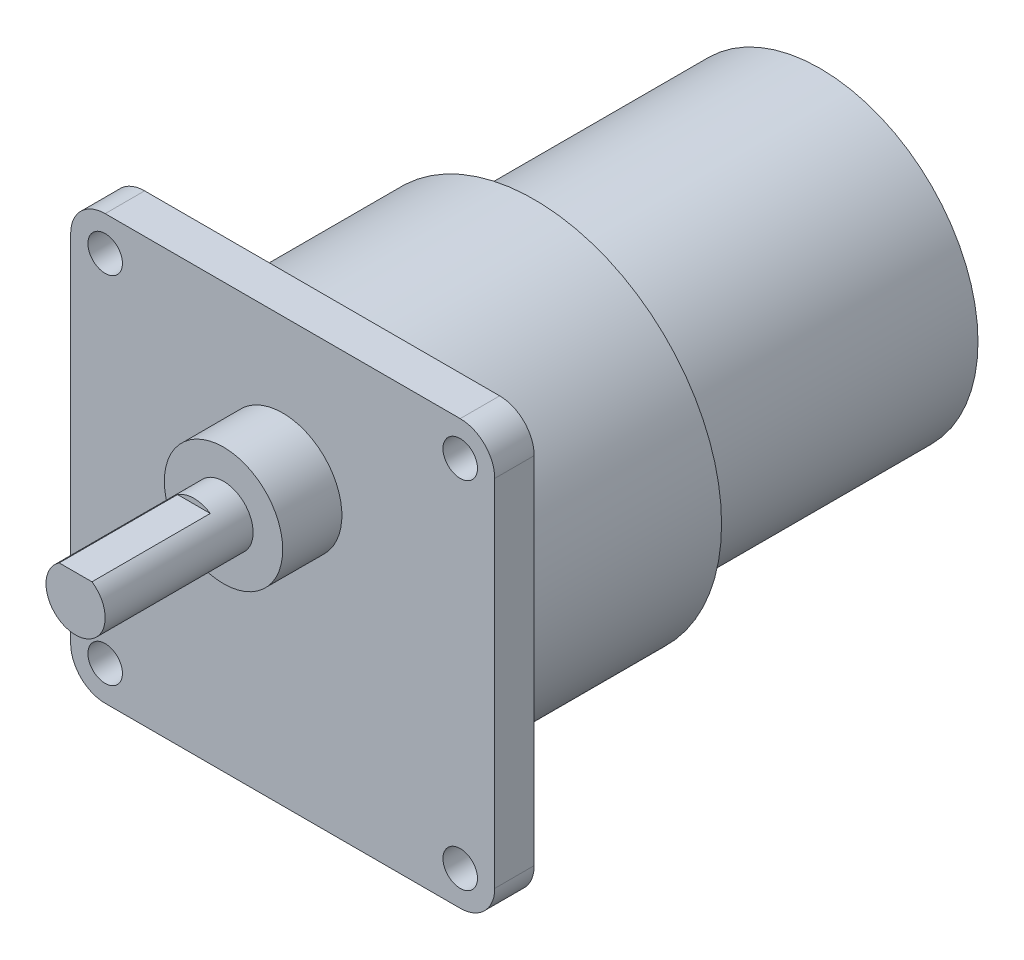
from build123d import *

# Parameters (mm, degrees)
SKETCH_1_W          = 43
SKETCH_1_H          = 43
EXTRUDE_1_DEPTH     = 4
FILLET_1_R          = 3.5
SKETCH_2_R          = 1.75
CUT_EXTRUDE_1_DEPTH = 31.66757245
SKETCH_3_R          = 6
EXTRUDE_2_DEPTH     = 6
SKETCH_4_R          = 3
EXTRUDE_3_DEPTH     = 15
CUT_EXTRUDE_START   = -12
CUT_EXTRUDE_2_DEPTH = 12
SKETCH_6_R          = 19
EXTRUDE_4_DEPTH     = 21.5
SKETCH_7_R          = 16
EXTRUDE_5_DEPTH     = 29


with BuildPart() as part:
    # 스케치1 → 보스-돌출1 (new body)
    with BuildSketch(Plane.XY):
        Rectangle(SKETCH_1_W, SKETCH_1_H)
    extrude(amount=EXTRUDE_1_DEPTH)

    # 필렛1
    fillet_1_edges = [part.edges().sort_by_distance(p)[0] for p in [
        (21.5, -21.5, 2),
        (-21.5, -21.5, 2),
        (-21.5, 21.5, 2),
        (21.5, 21.5, 2),
    ]]
    fillet(fillet_1_edges, radius=FILLET_1_R)

    # 스케치2 → 컷-돌출1 (cut, through all)
    with BuildSketch(Plane.XY.offset(4)):
        with Locations((18, 18)):
            Circle(SKETCH_2_R)
        with Locations(Location((-18, 18, 0), (0, 0, 180))):
            Circle(SKETCH_2_R)
        with Locations(Location((18, -18, 0), (0, 0, 180))):
            Circle(SKETCH_2_R)
        with Locations((-18, -18)):
            Circle(SKETCH_2_R)
    extrude(amount=-CUT_EXTRUDE_1_DEPTH, mode=Mode.SUBTRACT)

    # 스케치3 → 보스-돌출2 (add)
    with BuildSketch(Plane.XY.offset(4)):
        with Locations(Location((0, 7, 0), (0, 0, 180))):
            Circle(SKETCH_3_R)
    extrude(amount=EXTRUDE_2_DEPTH)

    # 스케치4 → 보스-돌출3 (add)
    with BuildSketch(Plane.XY.offset(10)):
        with Locations((0, 7)):
            Circle(SKETCH_4_R)
    extrude(amount=EXTRUDE_3_DEPTH)

    # 스케치5 → 컷-돌출2 (cut)
    with BuildSketch(Plane.XY.offset(25).offset(CUT_EXTRUDE_START)):
        with BuildLine():
            Line((-1.658312395, 9.5), (1.658312395, 9.5))
            ThreePointArc((1.658312395, 9.5), (0, 10), (-1.658312395, 9.5))
        make_face()
    extrude(amount=CUT_EXTRUDE_2_DEPTH, mode=Mode.SUBTRACT)

    # 스케치6 → 보스-돌출4 (add)
    with BuildSketch(Plane(origin=(0, 0, 0), x_dir=(-1, 0, 0), z_dir=(0, 0, -1))):
        Circle(SKETCH_6_R)
    extrude(amount=EXTRUDE_4_DEPTH)

    # 스케치7 → 보스-돌출5 (add)
    with BuildSketch(Plane(origin=(0, 0, -21.5), x_dir=(-1, 0, 0), z_dir=(0, 0, -1))):
        with Locations(Location((0, 0, 0), (0, 0, 180))):
            Circle(SKETCH_7_R)
    extrude(amount=EXTRUDE_5_DEPTH)


solid = part.part
